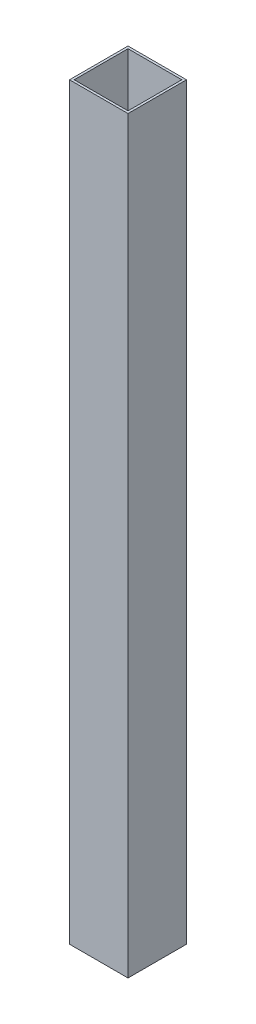
from build123d import *

# Parameters (mm, degrees)
SKETCH1_W           = 50
SKETCH1_H           = 50
SKETCH1_W_2         = 46
SKETCH1_H_2         = 46
BOSS_EXTRUDE1_DEPTH = 640


with BuildPart() as part:
    # Sketch1 → Boss-Extrude1 (new body)
    with BuildSketch(Plane(origin=(0, 0, 0), x_dir=(1, 0, 0), z_dir=(0, 1, 0))):
        Rectangle(SKETCH1_W, SKETCH1_H)
        Rectangle(SKETCH1_W_2, SKETCH1_H_2, mode=Mode.SUBTRACT)
    extrude(amount=BOSS_EXTRUDE1_DEPTH)


solid = part.part
